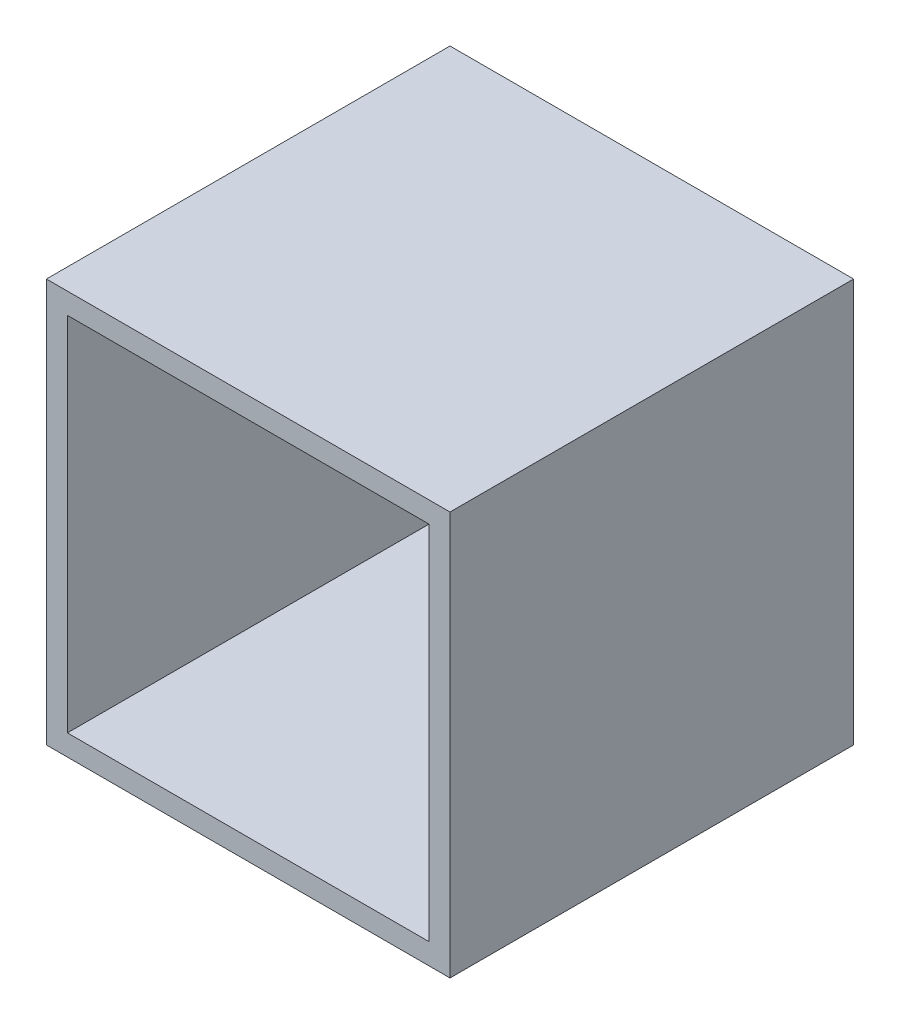
from build123d import *

# Parameters (mm, degrees)
SKETCH1_2_W         = 63.5
SKETCH1_2_H         = 63.5
SKETCH1_2_W_2       = 56.896
SKETCH1_2_H_2       = 56.896
BOSS_EXTRUDE1_DEPTH = 63.5


with BuildPart() as part:
    # Sketch1<2> → Boss-Extrude1 (new body)
    with BuildSketch(Plane.XY):
        Rectangle(SKETCH1_2_W, SKETCH1_2_H)
        Rectangle(SKETCH1_2_W_2, SKETCH1_2_H_2, mode=Mode.SUBTRACT)
    extrude(amount=BOSS_EXTRUDE1_DEPTH)


solid = part.part
